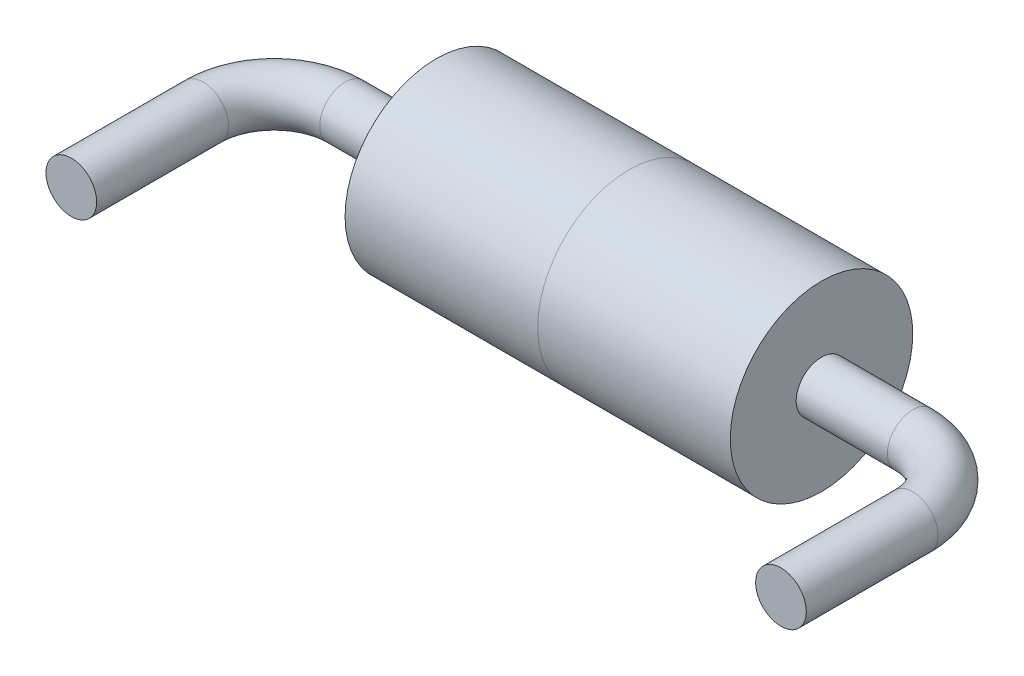
from build123d import *

# Parameters (mm, degrees)
SKETCH_2_R = 0.25
SKETCH_7_R = 0.9


with BuildPart() as part:
    # По траектории1: sweep along a path in Эскиз1
    with BuildLine(Plane(origin=(0, 0, 0), x_dir=(1, 0, 0), z_dir=(0, 1, 0))) as sweep_1_path:
        Line((-7, -2), (-7, -0.7))
        ThreePointArc((-7, -0.7), (-6.794974747, -0.205025253), (-6.3, 0))
        Line((-6.3, 0), (-0.7, 0))
        ThreePointArc((-0.7, 0), (-0.205025253, -0.205025253), (0, -0.7))
        Line((0, -0.7), (0, -2))
    # Эскиз2 → По траектории1 (sweep)
    with BuildSketch(Plane.XY.offset(2)):
        Circle(SKETCH_2_R)
    sweep(path=sweep_1_path.line)

    # По траектории2: sweep along a path in Эскиз6
    with BuildLine(Plane(origin=(0, 0, 0), x_dir=(1, 0, 0), z_dir=(0, 1, 0))) as sweep_2_path:
        Line((-5.4, 0), (-3.5, 0))
        Line((-3.5, 0), (-1.6, 0))
    # Эскиз7 → По траектории2 (sweep)
    with BuildSketch(Plane(origin=(-5.4, 0, 0), x_dir=(0, 0, -1), z_dir=(1, 0, 0))):
        Circle(SKETCH_7_R)
    sweep(path=sweep_2_path.line)


solid = part.part
